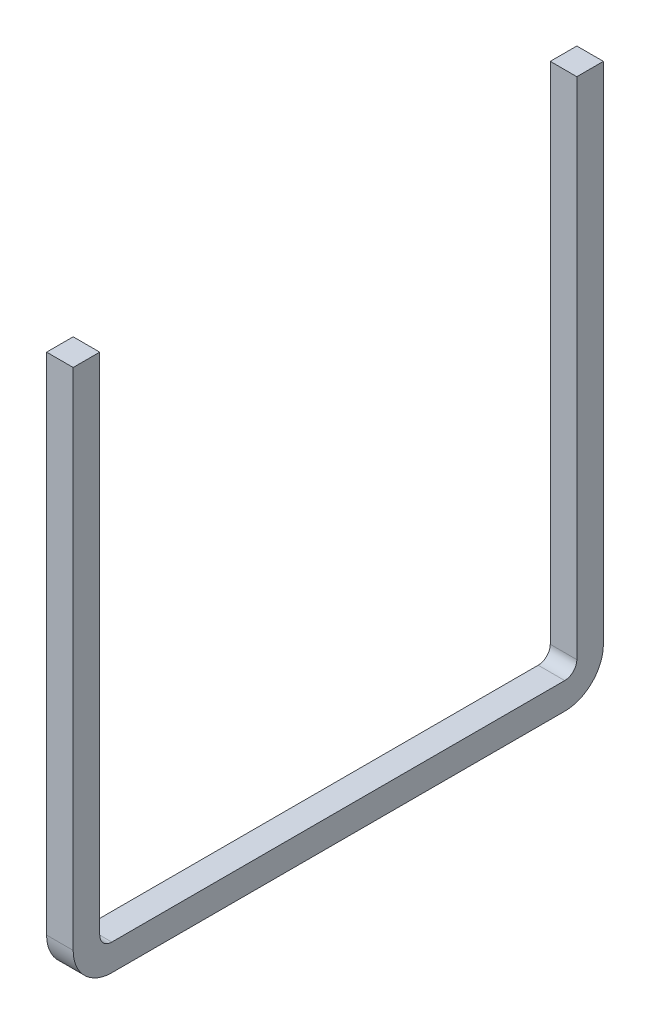
from build123d import *

# Parameters (mm, degrees)
BOSS_EXTRUDE1_DEPTH = 5.588


with BuildPart() as part:
    # Sketch1 → Boss-Extrude1 (new body)
    with BuildSketch(Plane(origin=(0, 0, 0), x_dir=(0, 0, -1), z_dir=(1, 0, 0))):
        with BuildLine():
            Line((-47.625, 0), (47.625, 0))
            ThreePointArc((47.625, 0), (53.372363917, 2.380636083), (55.753, 8.128))
            Line((55.753, 8.128), (55.753, 114.3))
            Line((55.753, 114.3), (50.165, 114.3))
            Line((50.165, 114.3), (50.165, 8.128))
            ThreePointArc((50.165, 8.128), (49.421051224, 6.331948776), (47.625, 5.588))
            Line((47.625, 5.588), (-47.625, 5.588))
            ThreePointArc((-47.625, 5.588), (-49.421051224, 6.331948776), (-50.165, 8.128))
            Line((-50.165, 8.128), (-50.165, 114.3))
            Line((-50.165, 114.3), (-55.753, 114.3))
            Line((-55.753, 114.3), (-55.753, 8.128))
            ThreePointArc((-55.753, 8.128), (-53.372363917, 2.380636083), (-47.625, 0))
        make_face()
    extrude(amount=BOSS_EXTRUDE1_DEPTH)


solid = part.part
